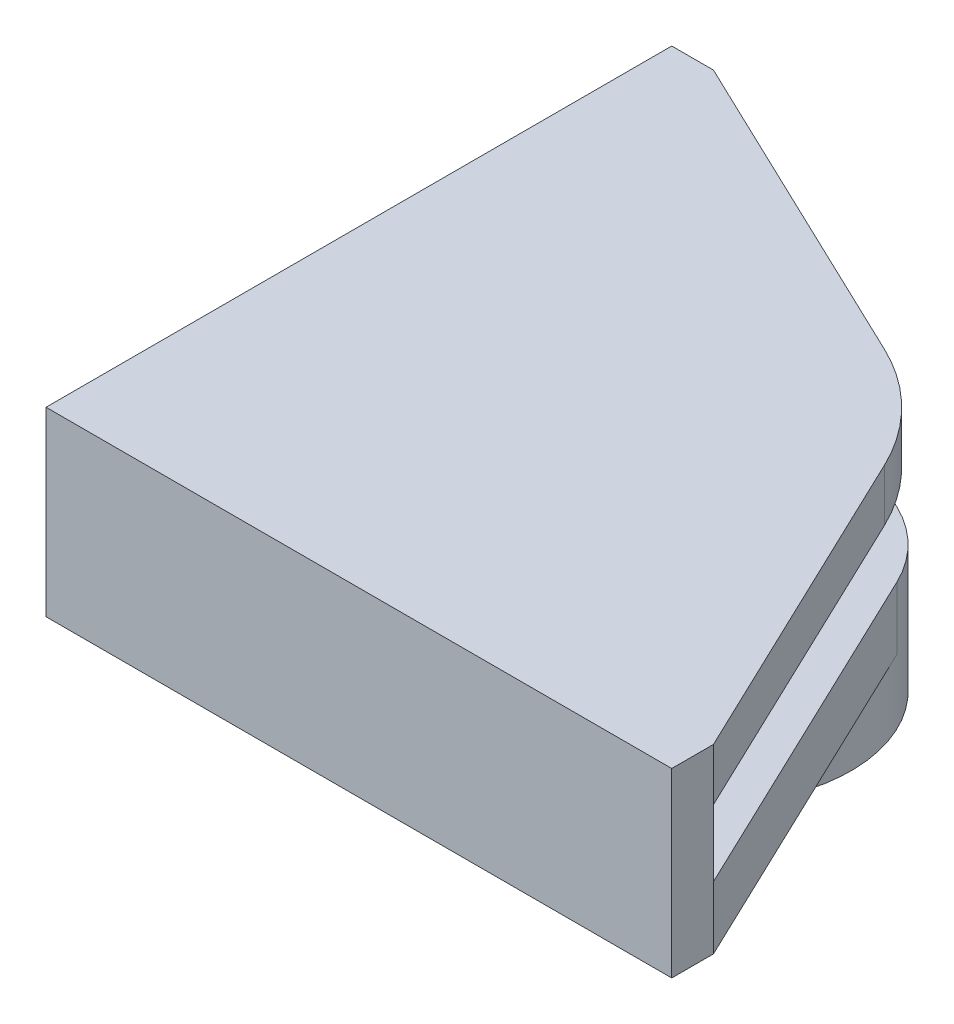
from build123d import *

# Parameters (mm, degrees)
BOSS_EXTRUDE1_DEPTH      = 3.1
BOSS_EXTRUDE2_DEPTH      = 3
BOSS_EXTRUDE4_DEPTH      = 3.2
BOSS_EXTRUDE4_DEPTH_BACK = 3
BOSS_EXTRUDE5_DEPTH      = 2.5


with BuildPart() as part:
    # Sketch1 → Boss-Extrude1 (new body)
    with BuildSketch(Plane(origin=(0, 0, 0), x_dir=(1, 0, 0), z_dir=(0, 1, 0))):
        with BuildLine():
            ThreePointArc((20.6, 14), (16.525710654, 20.097604915), (9.333095244, 18.666904756))
            Line((9.333095244, 18.666904756), (10.393755416, 17.606244584))
            ThreePointArc((10.393755416, 17.606244584), (15.951685505, 18.711785616), (19.1, 14))
            ThreePointArc((19.1, 14), (18.711785616, 12.048314495), (17.606244584, 10.393755416))
            Line((17.606244584, 10.393755416), (18.666904756, 9.333095244))
            ThreePointArc((18.666904756, 9.333095244), (20.097604915, 11.474289346), (20.6, 14))
        make_face()
        with BuildLine():
            Line((10.393755416, 17.606244584), (9.333095244, 18.666904756))
            ThreePointArc((9.333095244, 18.666904756), (9.333095244, 9.333095244), (18.666904756, 9.333095244))
            Line((18.666904756, 9.333095244), (17.606244584, 10.393755416))
            ThreePointArc((17.606244584, 10.393755416), (10.393755416, 10.393755416), (10.393755416, 17.606244584))
        make_face()
    extrude(amount=BOSS_EXTRUDE1_DEPTH)

    # Sketch2 → Boss-Extrude2 (add)
    with BuildSketch(Plane(origin=(0, 3.1, 0), x_dir=(1, 0, 0), z_dir=(0, 1, 0))):
        with BuildLine():
            Line((16.844257653, 19.955686224), (0, 28))
            Line((0, 28), (4.242424242, 23.757575758))
            Line((4.242424242, 23.757575758), (8.980990355, 21.494578276))
            Line((8.980990355, 21.494578276), (7.411542732, 20.588457268))
            Line((7.411542732, 20.588457268), (9.333095244, 18.666904756))
            ThreePointArc((9.333095244, 18.666904756), (12.883868272, 20.504940428), (16.844257653, 19.955686224))
        make_face()
        with BuildLine():
            Line((0, 28), (0, 0))
            Line((0, 0), (9.333095244, 9.333095244))
            ThreePointArc((9.333095244, 9.333095244), (7.4, 14), (9.333095244, 18.666904756))
            Line((9.333095244, 18.666904756), (7.411542732, 20.588457268))
            Line((7.411542732, 20.588457268), (4, 18.618802154))
            Line((4, 18.618802154), (4, 23.873350327))
            Line((4, 23.873350327), (4.242424242, 23.757575758))
            Line((4.242424242, 23.757575758), (0, 28))
        make_face()
        with BuildLine():
            Line((9.333095244, 9.333095244), (0, 0))
            Line((0, 0), (28, 0))
            Line((28, 0), (23.757575758, 4.242424242))
            Line((23.757575758, 4.242424242), (23.873350327, 4))
            Line((23.873350327, 4), (18.618802154, 4))
            Line((18.618802154, 4), (20.588457268, 7.411542732))
            Line((20.588457268, 7.411542732), (18.666904756, 9.333095244))
            ThreePointArc((18.666904756, 9.333095244), (14, 7.4), (9.333095244, 9.333095244))
        make_face()
        with BuildLine():
            Line((23.757575758, 4.242424242), (28, 0))
            Line((28, 0), (19.955686224, 16.844257653))
            ThreePointArc((19.955686224, 16.844257653), (20.436906442, 15.458161671), (20.6, 14))
            ThreePointArc((20.6, 14), (20.097604915, 11.474289346), (18.666904756, 9.333095244))
            Line((18.666904756, 9.333095244), (20.588457268, 7.411542732))
            Line((20.588457268, 7.411542732), (21.494578276, 8.980990355))
            Line((21.494578276, 8.980990355), (23.757575758, 4.242424242))
        make_face()
        with BuildLine():
            ThreePointArc((9.333095244, 18.666904756), (7.4, 14), (9.333095244, 9.333095244))
            Line((9.333095244, 9.333095244), (10.393755416, 10.393755416))
            ThreePointArc((10.393755416, 10.393755416), (8.9, 14), (10.393755416, 17.606244584))
            Line((10.393755416, 17.606244584), (9.333095244, 18.666904756))
        make_face()
        with BuildLine():
            Line((10.393755416, 10.393755416), (9.333095244, 9.333095244))
            ThreePointArc((9.333095244, 9.333095244), (14, 7.4), (18.666904756, 9.333095244))
            Line((18.666904756, 9.333095244), (17.606244584, 10.393755416))
            ThreePointArc((17.606244584, 10.393755416), (14, 8.9), (10.393755416, 10.393755416))
        make_face()
        with BuildLine():
            ThreePointArc((18.666904756, 18.666904756), (17.810463174, 19.388911801), (16.844257653, 19.955686224))
            ThreePointArc((16.844257653, 19.955686224), (12.883868272, 20.504940428), (9.333095244, 18.666904756))
            Line((9.333095244, 18.666904756), (10.393755416, 17.606244584))
            ThreePointArc((10.393755416, 17.606244584), (14, 19.1), (17.606244584, 17.606244584))
            Line((17.606244584, 17.606244584), (18.666904756, 18.666904756))
        make_face()
        with BuildLine():
            ThreePointArc((20.6, 14), (20.436906442, 15.458161671), (19.955686224, 16.844257653))
            ThreePointArc((19.955686224, 16.844257653), (19.388911801, 17.810463174), (18.666904756, 18.666904756))
            Line((18.666904756, 18.666904756), (17.606244584, 17.606244584))
            ThreePointArc((17.606244584, 17.606244584), (18.711785616, 15.951685505), (19.1, 14))
            ThreePointArc((19.1, 14), (18.711785616, 12.048314495), (17.606244584, 10.393755416))
            Line((17.606244584, 10.393755416), (18.666904756, 9.333095244))
            ThreePointArc((18.666904756, 9.333095244), (20.097604915, 11.474289346), (20.6, 14))
        make_face()
        with BuildLine():
            ThreePointArc((10.393755416, 17.606244584), (8.9, 14), (10.393755416, 10.393755416))
            Line((10.393755416, 10.393755416), (14, 14))
            Line((14, 14), (10.393755416, 17.606244584))
        make_face()
        with BuildLine():
            Line((14, 14), (10.393755416, 10.393755416))
            ThreePointArc((10.393755416, 10.393755416), (14, 8.9), (17.606244584, 10.393755416))
            Line((17.606244584, 10.393755416), (14, 14))
        make_face()
        with BuildLine():
            Line((17.606244584, 17.606244584), (14, 14))
            Line((14, 14), (17.606244584, 10.393755416))
            ThreePointArc((17.606244584, 10.393755416), (18.711785616, 12.048314495), (19.1, 14))
            ThreePointArc((19.1, 14), (18.711785616, 15.951685505), (17.606244584, 17.606244584))
        make_face()
        with BuildLine():
            Line((10.393755416, 17.606244584), (14, 14))
            Line((14, 14), (17.606244584, 17.606244584))
            ThreePointArc((17.606244584, 17.606244584), (14, 19.1), (10.393755416, 17.606244584))
        make_face()
    extrude(amount=BOSS_EXTRUDE2_DEPTH)

    # Sketch4 → Boss-Extrude4 (add, two sides: drawn at the far end of the back side and taken through both)
    with BuildSketch(Plane(origin=(0, 6.1, 0), x_dir=(1, 0, 0), z_dir=(0, 1, 0)).offset(-BOSS_EXTRUDE4_DEPTH_BACK)):
        Polygon((0, 28), (-2, 28), (-2, -2), (28, -2), (28, 0), (0, 0), align=None)
    extrude(amount=BOSS_EXTRUDE4_DEPTH + BOSS_EXTRUDE4_DEPTH_BACK)

    # Sketch5 → Boss-Extrude5 (add)
    with BuildSketch(Plane(origin=(0, 9.3, 0), x_dir=(1, 0, 0), z_dir=(0, 1, 0))):
        with BuildLine():
            Line((-2, 28), (0, 28))
            Line((0, 28), (15.695653699, 20.504225127))
            ThreePointArc((15.695653699, 20.504225127), (18.512471949, 18.512471949), (20.504225127, 15.695653699))
            Line((20.504225127, 15.695653699), (28, 0))
            Line((28, 0), (28, -2))
            Line((28, -2), (-2, -2))
            Line((-2, -2), (-2, 28))
        make_face()
    extrude(amount=BOSS_EXTRUDE5_DEPTH)


solid = part.part
